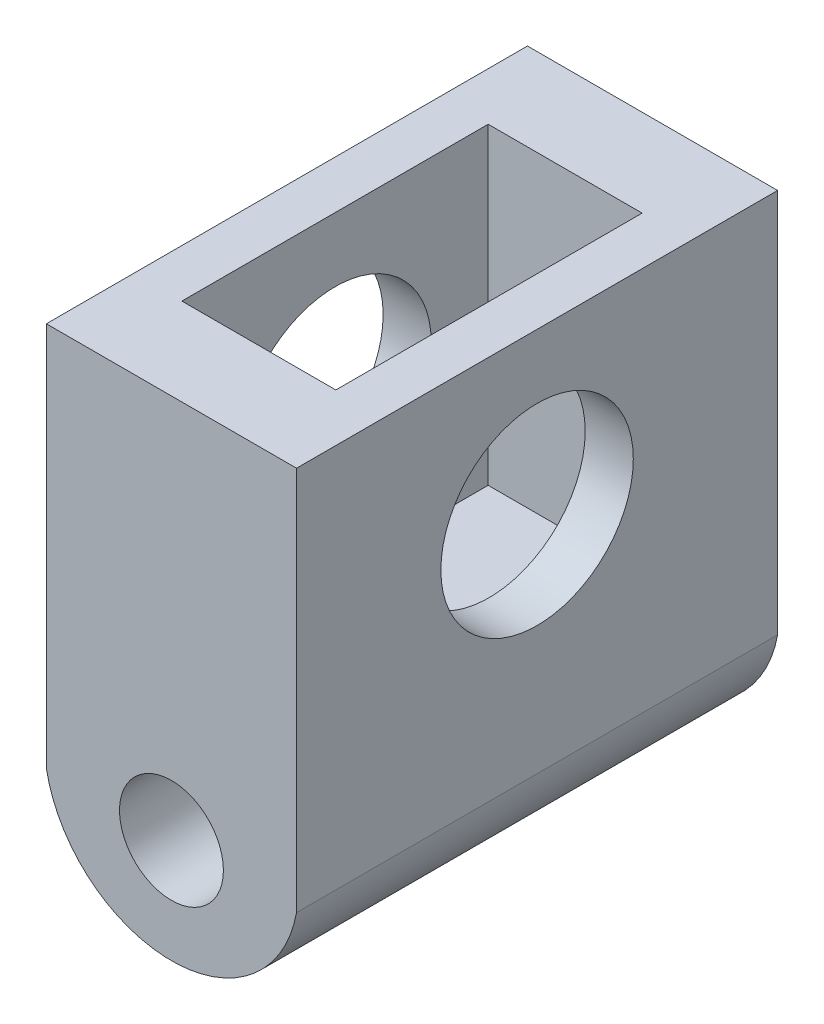
from build123d import *

# Parameters (mm, degrees)
BOSS_EXTRUDE1_DEPTH      = 15
BOSS_EXTRUDE1_DEPTH_BACK = 15
SKETCH1_R                = 3.2385
CUT_EXTRUDE1_START       = -3
SKETCH2_W                = 19.1
SKETCH2_H                = 19.5
CUT_EXTRUDE1_DEPTH       = 9.6
CUT_EXTRUDE2_DEPTH       = 33.316559223
CUT_EXTRUDE2_DEPTH_BACK  = 33.316559223
SKETCH3_R                = 6


with BuildPart() as part:
    # Sketch1 → Boss-Extrude1 (new, two sides: drawn at the far end of the back side and taken through both)
    with BuildSketch(Plane.XY.offset(-BOSS_EXTRUDE1_DEPTH_BACK)):
        with BuildLine():
            Line((-7.8, 0), (-7.8, 24))
            Line((-7.8, 24), (7.8, 24))
            Line((7.8, 24), (7.8, 0))
            ThreePointArc((7.8, 0), (0, -6.5), (-7.8, 0))
        make_face()
        Circle(SKETCH1_R, mode=Mode.SUBTRACT)
    extrude(amount=BOSS_EXTRUDE1_DEPTH + BOSS_EXTRUDE1_DEPTH_BACK)

    # Sketch2 → Cut-Extrude1 (cut)
    with BuildSketch(Plane.ZY.offset(7.8).offset(CUT_EXTRUDE1_START)):
        with Locations((0, 14.25)):
            Rectangle(SKETCH2_W, SKETCH2_H)
    extrude(amount=-CUT_EXTRUDE1_DEPTH, mode=Mode.SUBTRACT)

    # Sketch3 → Cut-Extrude2 (cut, two sides: drawn at the far end of the back side and taken through both)
    with BuildSketch(Plane.ZY.offset(7.8).offset(-CUT_EXTRUDE2_DEPTH_BACK)):
        with Locations((0, 14)):
            Circle(SKETCH3_R)
    extrude(amount=CUT_EXTRUDE2_DEPTH + CUT_EXTRUDE2_DEPTH_BACK, mode=Mode.SUBTRACT)


solid = part.part
